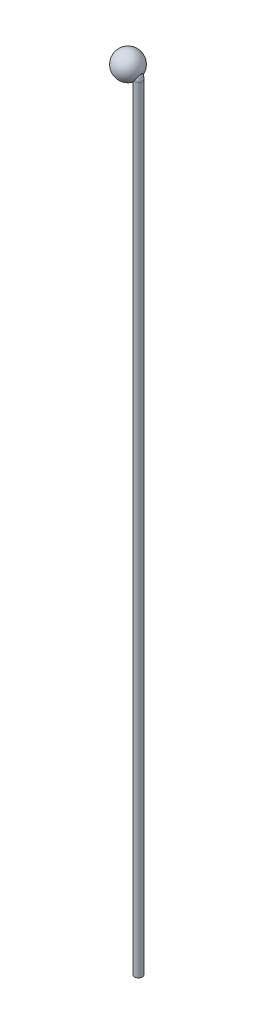
from build123d import *

# Parameters (mm, degrees)
SKETCH1_R = 0.15


with BuildPart() as part:
    # Sweep1: sweep along a path in Sketch3
    with BuildLine(Plane.XY) as sweep1_path:
        Line((0, 0), (0.1, 0))
        ThreePointArc((0.1, 0), (0.312132034, -0.087867966), (0.4, -0.3))
        Line((0.4, -0.3), (0.4, -30))
    # Sketch1 → Sweep1 (sweep)
    with BuildSketch(Plane(origin=(0, 0, 0), x_dir=(0, 0, -1), z_dir=(1, 0, 0))):
        Circle(SKETCH1_R)
    sweep(path=sweep1_path.line)

    # Sketch4 → Revolve2 (revolve)
    with BuildSketch(Plane.ZY):
        with BuildLine():
            Line((0, 0.5), (0, -0.5))
            ThreePointArc((0, -0.5), (-0.5, 0), (0, 0.5))
        make_face()
    revolve(axis=Axis((0, 0.5, 0), (0, -1, 0)))


solid = part.part
